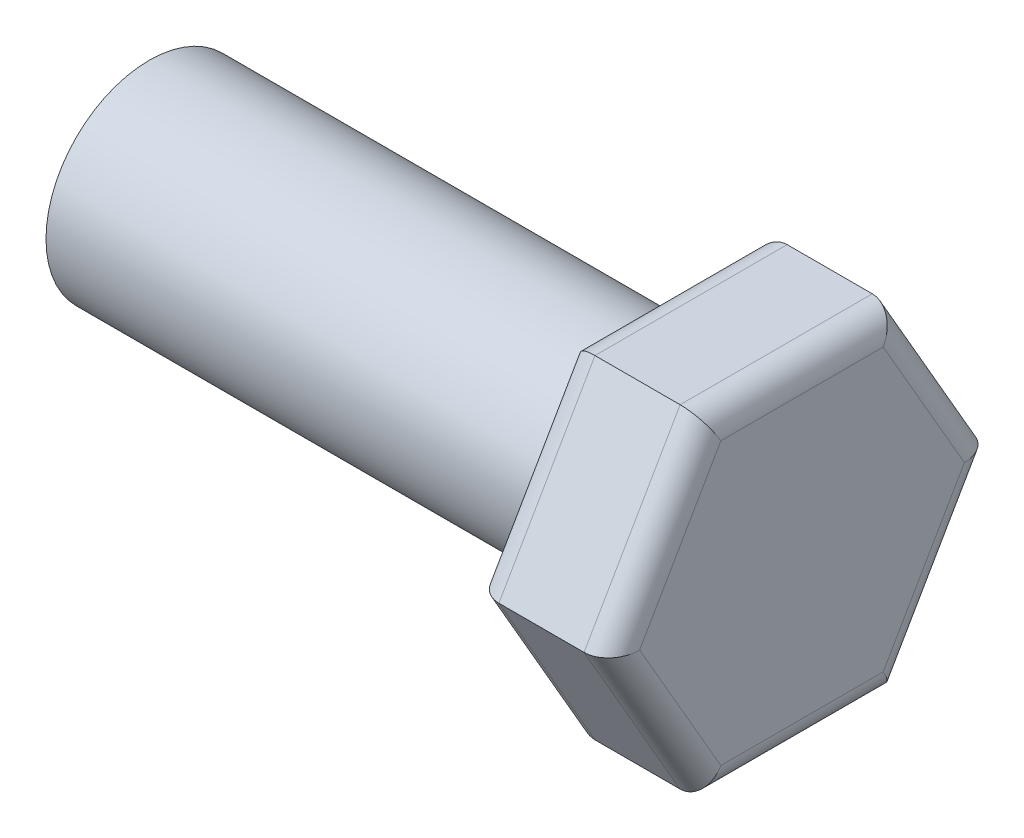
from build123d import *

# Parameters (mm, degrees)
BOSS_EXTRUDE1_DEPTH = 5.3
SKETCH2_R           = 4
BOSS_EXTRUDE2_DEPTH = 20
FILLET1_R           = 1


with BuildPart() as part:
    # Sketch1 → Boss-Extrude1 (new body)
    with BuildSketch(Plane(origin=(0, 0, 0), x_dir=(0, 0, -1), z_dir=(1, 0, 0))):
        Polygon((-3.723909236, 6.45), (-7.447818473, 0), (-3.723909236, -6.45), (3.723909236, -6.45), (7.447818473, 0), (3.723909236, 6.45), align=None)
    extrude(amount=BOSS_EXTRUDE1_DEPTH)

    # Sketch2 → Boss-Extrude2 (add)
    with BuildSketch(Plane(origin=(0, 0, 0), x_dir=(0, 0, -1), z_dir=(1, 0, 0))):
        Circle(SKETCH2_R)
    extrude(amount=-BOSS_EXTRUDE2_DEPTH)

    # Fillet1
    fillet1_edges = [part.edges().sort_by_distance(p)[0] for p in [
        (5.3, -3.225, 5.585863854),
        (5.3, -6.45, 0),
        (5.3, -3.225, -5.585863854),
        (5.3, 3.225, -5.585863854),
        (5.3, 6.45, 0),
        (0, 3.225, -5.585863854),
        (0, -3.225, -5.585863854),
        (0, -6.45, 0),
        (0, -3.225, 5.585863854),
        (0, 3.225, 5.585863854),
        (0, 6.45, 0),
        (5.3, 3.225, 5.585863854),
    ]]
    fillet(fillet1_edges, radius=FILLET1_R)


solid = part.part
